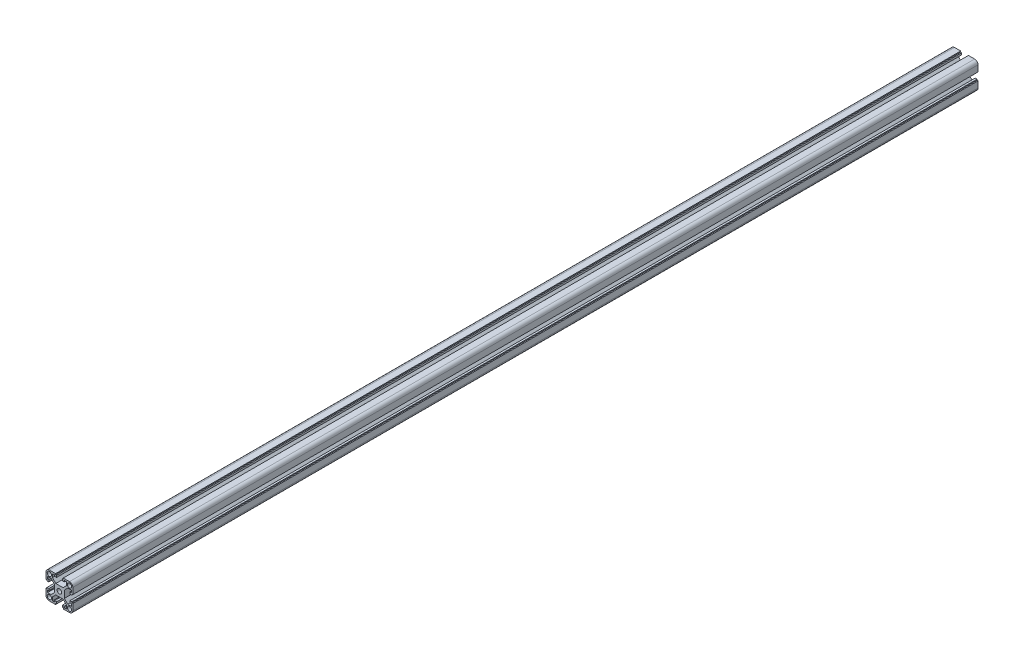
from build123d import *

# Parameters (mm, degrees)
SKETCH_1_R      = 3.4
SKETCH_1_R_2    = 3.15
EXTRUDE_1_DEPTH = 675


with BuildPart() as part:
    # Эскиз1 → Бобышка-Вытянуть1 (new, symmetric)
    with BuildSketch(Plane.XY):
        with BuildLine():
            Line((-15, 20), (-5.727351849, 20))
            Line((-5.727351849, 20), (-5.727351849, 18.530416438))
            Line((-5.727351849, 18.530416438), (-4.25, 18.530416438))
            Line((-4.25, 18.530416438), (-4.25, 15.732027397))
            Line((-4.25, 15.732027397), (-7.111831817, 15.732027397))
            Line((-7.111831817, 15.732027397), (-7.111831817, 17.7))
            Line((-7.111831817, 17.7), (-10.5, 17.7))
            Line((-10.5, 17.7), (-10.5, 12.479898987))
            Line((-10.5, 12.479898987), (-5.420101013, 7.4))
            Line((-5.420101013, 7.4), (5.420101013, 7.4))
            Line((5.420101013, 7.4), (10.5, 12.479898987))
            Line((10.5, 12.479898987), (10.5, 17.7))
            Line((10.5, 17.7), (7.111831817, 17.7))
            Line((7.111831817, 17.7), (7.111831817, 15.732027397))
            Line((7.111831817, 15.732027397), (4.25, 15.732027397))
            Line((4.25, 15.732027397), (4.25, 18.530416438))
            Line((4.25, 18.530416438), (5.727351849, 18.530416438))
            Line((5.727351849, 18.530416438), (5.727351849, 20))
            Line((5.727351849, 20), (15, 20))
            ThreePointArc((15, 20), (18.535533906, 18.535533906), (20, 15))
            Line((20, 15), (20, 5.727351849))
            Line((20, 5.727351849), (18.530416438, 5.727351849))
            Line((18.530416438, 5.727351849), (18.530416438, 4.25))
            Line((18.530416438, 4.25), (15.732027397, 4.25))
            Line((15.732027397, 4.25), (15.732027397, 7.111831817))
            Line((15.732027397, 7.111831817), (17.7, 7.111831817))
            Line((17.7, 7.111831817), (17.7, 10.5))
            Line((17.7, 10.5), (12.479898987, 10.5))
            Line((12.479898987, 10.5), (7.4, 5.420101013))
            Line((7.4, 5.420101013), (7.4, -5.420101013))
            Line((7.4, -5.420101013), (12.479898987, -10.5))
            Line((12.479898987, -10.5), (17.7, -10.5))
            Line((17.7, -10.5), (17.7, -7.111831817))
            Line((17.7, -7.111831817), (15.732027397, -7.111831817))
            Line((15.732027397, -7.111831817), (15.732027397, -4.25))
            Line((15.732027397, -4.25), (18.530416438, -4.25))
            Line((18.530416438, -4.25), (18.530416438, -5.727351849))
            Line((18.530416438, -5.727351849), (20, -5.727351849))
            Line((20, -5.727351849), (20, -15))
            ThreePointArc((20, -15), (18.535533906, -18.535533906), (15, -20))
            Line((15, -20), (5.727351849, -20))
            Line((5.727351849, -20), (5.727351849, -18.530416438))
            Line((5.727351849, -18.530416438), (4.25, -18.530416438))
            Line((4.25, -18.530416438), (4.25, -15.732027397))
            Line((4.25, -15.732027397), (7.111831817, -15.732027397))
            Line((7.111831817, -15.732027397), (7.111831817, -17.7))
            Line((7.111831817, -17.7), (10.5, -17.7))
            Line((10.5, -17.7), (10.5, -12.479898987))
            Line((10.5, -12.479898987), (5.420101013, -7.4))
            Line((5.420101013, -7.4), (-5.420101013, -7.4))
            Line((-5.420101013, -7.4), (-10.5, -12.479898987))
            Line((-10.5, -12.479898987), (-10.5, -17.7))
            Line((-10.5, -17.7), (-7.111831817, -17.7))
            Line((-7.111831817, -17.7), (-7.111831817, -15.732027397))
            Line((-7.111831817, -15.732027397), (-4.25, -15.732027397))
            Line((-4.25, -15.732027397), (-4.25, -18.530416438))
            Line((-4.25, -18.530416438), (-5.727351849, -18.530416438))
            Line((-5.727351849, -18.530416438), (-5.727351849, -20))
            Line((-5.727351849, -20), (-15, -20))
            ThreePointArc((-15, -20), (-18.535533906, -18.535533906), (-20, -15))
            Line((-20, -15), (-20, -5.727351849))
            Line((-20, -5.727351849), (-18.530416438, -5.727351849))
            Line((-18.530416438, -5.727351849), (-18.530416438, -4.25))
            Line((-18.530416438, -4.25), (-15.732027397, -4.25))
            Line((-15.732027397, -4.25), (-15.732027397, -7.111831817))
            Line((-15.732027397, -7.111831817), (-17.7, -7.111831817))
            Line((-17.7, -7.111831817), (-17.7, -10.5))
            Line((-17.7, -10.5), (-12.479898987, -10.5))
            Line((-12.479898987, -10.5), (-7.4, -5.420101013))
            Line((-7.4, -5.420101013), (-7.4, 5.420101013))
            Line((-7.4, 5.420101013), (-12.479898987, 10.5))
            Line((-12.479898987, 10.5), (-17.7, 10.5))
            Line((-17.7, 10.5), (-17.7, 7.111831817))
            Line((-17.7, 7.111831817), (-15.732027397, 7.111831817))
            Line((-15.732027397, 7.111831817), (-15.732027397, 4.25))
            Line((-15.732027397, 4.25), (-18.530416438, 4.25))
            Line((-18.530416438, 4.25), (-18.530416438, 5.727351849))
            Line((-18.530416438, 5.727351849), (-20, 5.727351849))
            Line((-20, 5.727351849), (-20, 15))
            ThreePointArc((-20, 15), (-18.535533906, 18.535533906), (-15, 20))
        make_face()
        Circle(SKETCH_1_R, mode=Mode.SUBTRACT)
        with Locations((-15, 15)):
            Circle(SKETCH_1_R_2, mode=Mode.SUBTRACT)
        with Locations((15, 15)):
            Circle(SKETCH_1_R_2, mode=Mode.SUBTRACT)
        with Locations((15, -15)):
            Circle(SKETCH_1_R_2, mode=Mode.SUBTRACT)
        with Locations((-15, -15)):
            Circle(SKETCH_1_R_2, mode=Mode.SUBTRACT)
    extrude(amount=EXTRUDE_1_DEPTH, both=True)


solid = part.part
